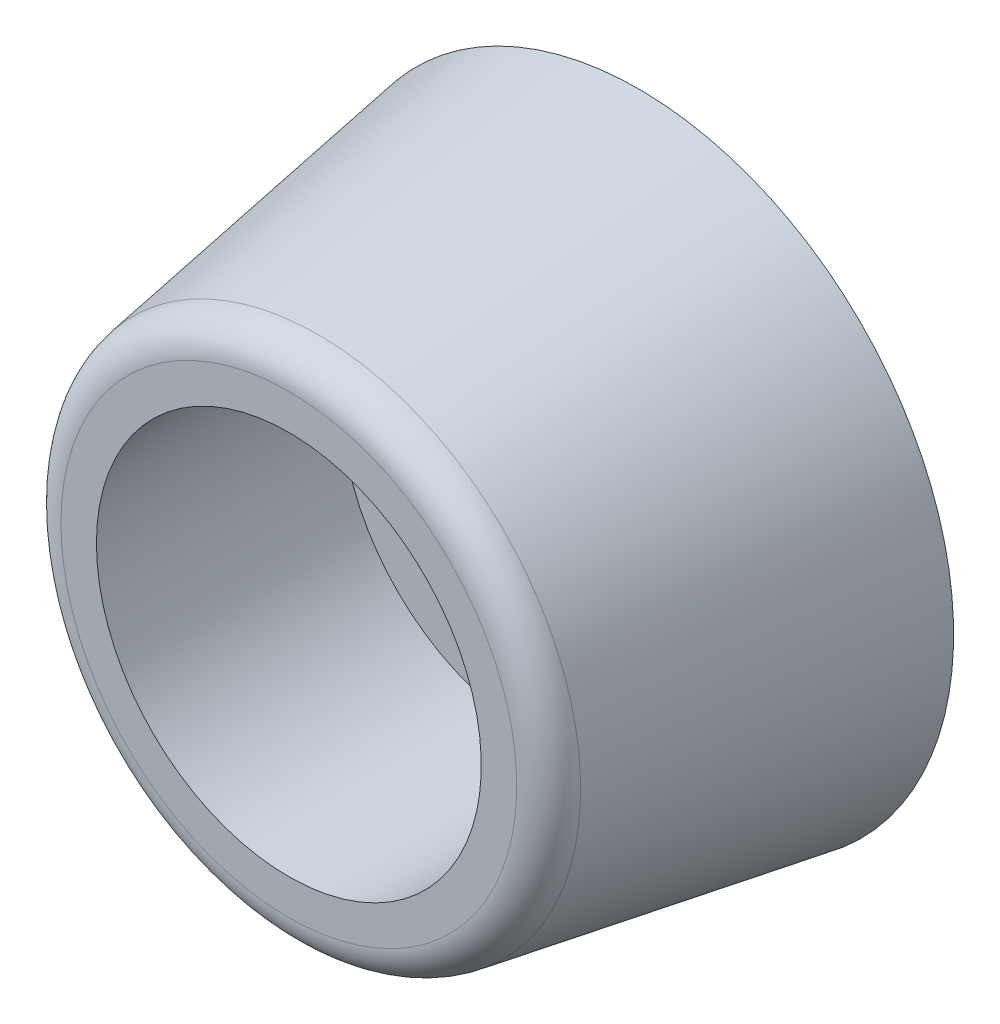
from build123d import *


with BuildPart() as part:
    # Эскиз1 → Повернуть1 (revolve)
    with BuildSketch(Plane(origin=(0, 0, 0), x_dir=(1, 0, 0), z_dir=(0, 1, 0))):
        with BuildLine():
            Line((-2.15, 0), (-9, 0))
            Line((-9, 0), (-7.5, -9.161575959))
            ThreePointArc((-7.5, -9.161575959), (-7.160605567, -9.762094469), (-6.513139721, -10))
            Line((-6.513139721, -10), (-5.5, -10))
            Line((-5.5, -10), (-5.5, -3))
            Line((-5.5, -3), (-2.15, -3))
            Line((-2.15, -3), (-2.15, 0))
        make_face()
    revolve(axis=Axis((0, 0, 0), (0, 0, 1)))


solid = part.part
